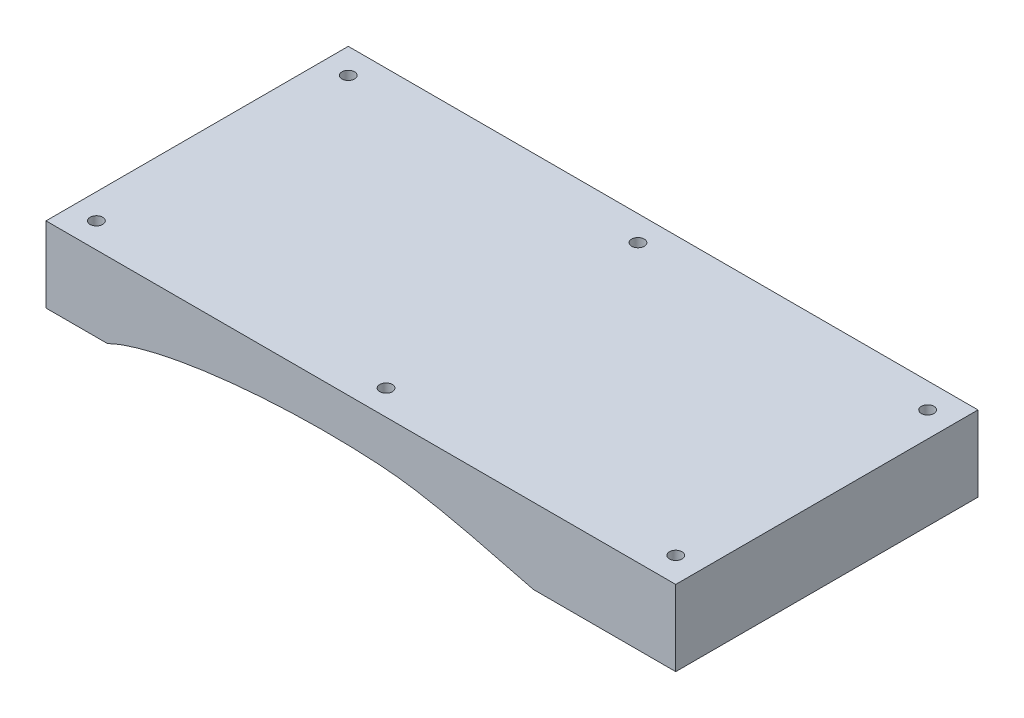
from build123d import *

# Parameters (mm, degrees)
BOSS_EXTRUDE1_DEPTH             = 120
SKETCH10_W                      = 2.5
SKETCH10_H                      = 10
F_5_0MM_DOWEL_HOLE1_AT_2_COUNT  = 2
F_5_0MM_DOWEL_HOLE1_AT_2_PITCH  = 230
F_5_0MM_DOWEL_HOLE1_AT_3_COUNT  = 2
F_5_0MM_DOWEL_HOLE1_AT_3_PITCH  = 250.79872408
F_5_0MM_DOWEL_HOLE1_AT_4_COUNT  = 2
F_5_0MM_DOWEL_HOLE1_AT_4_PITCH  = 152.397506541
F_5_0MM_DOWEL_HOLE1_AT_5_COUNT  = 2
F_5_0MM_DOWEL_HOLE1_AT_5_PITCH  = 100
F_5_0MM_DOWEL_HOLE1_AT_6_COUNT  = 2
F_5_0MM_DOWEL_HOLE1_AT_6_PITCH  = 115
SKETCH13_W                      = 5
SKETCH13_H                      = 20
F_10_0MM_DOWEL_HOLE1_AT_2_COUNT = 2
F_10_0MM_DOWEL_HOLE1_AT_2_PITCH = 115
F_10_0MM_DOWEL_HOLE1_AT_3_COUNT = 2
F_10_0MM_DOWEL_HOLE1_AT_3_PITCH = 230
F_10_0MM_DOWEL_HOLE1_AT_4_COUNT = 2
F_10_0MM_DOWEL_HOLE1_AT_4_PITCH = 250.79872408
F_10_0MM_DOWEL_HOLE1_AT_5_COUNT = 2
F_10_0MM_DOWEL_HOLE1_AT_5_PITCH = 152.397506541
F_10_0MM_DOWEL_HOLE1_AT_6_COUNT = 2
F_10_0MM_DOWEL_HOLE1_AT_6_PITCH = 100


with BuildPart() as part:
    # Sketch1 → Boss-Extrude1 (new body)
    with BuildSketch(Plane.XY):
        with BuildLine():
            Line((-20, 5), (4.406999064, 5))
            add(Edge.make_bspline(
                [(173.490575932, 5), (172.326342066, 5.286749118), (167.829693344, 6.405018282), (160.005568623, 8.421384221), (150.022959876, 10.929293239), (140.032690883, 13.242212873), (130.039576349, 15.224534417), (120.039677674, 16.776832577), (110.010328484, 17.519452934), (100.004268105, 17.93606864), (89.999557234, 18.039439262), (79.99597078, 17.88209955), (69.992122817, 17.447369698), (59.98803219, 16.737630926), (49.981633888, 15.747713143), (39.97167458, 14.434248174), (29.95037961, 12.743709227), (21.617032213, 10.901524907), (14.966560888, 9.053828582), (9.928778454, 7.425562721), (6.425978449, 5.993531691), (4.603660534, 5.099329751), (4.406999064, 5)],
                knots=[0.065553478, 0.065553478, 0.065553478, 0.065553478, 0.074294227, 0.099342978, 0.124359733, 0.149264719, 0.174009696, 0.198546974, 0.22290397, 0.247200686, 0.271477726, 0.295756352, 0.320054721, 0.344391349, 0.368786978, 0.393273071, 0.417900952, 0.442781229, 0.455381891, 0.468160436, 0.481314037, 0.482916031, 0.482916031, 0.482916031, 0.482916031], degree=3))
            Line((173.490575932, 5), (230, 5))
            Line((230, 5), (230, 35))
            Line((230, 35), (-20, 35))
            Line((-20, 35), (-20, 5))
        make_face()
    extrude(amount=BOSS_EXTRUDE1_DEPTH)

    # Sketch10 → Ø5.0mm Dowel Hole1 (revolve, cut)
    with BuildSketch(Plane(origin=(-10, 25, 10), x_dir=(0, 0, -1), z_dir=(1, 0, 0))):
        with Locations((1.25, 5)):
            Rectangle(SKETCH10_W, SKETCH10_H)
    f_5_0mm_dowel_hole1 = revolve(axis=Axis((-10, 18.65, 10), (0, 1, 0)), mode=Mode.SUBTRACT)

    # Ø5.0mm Dowel Hole1 at 2: Ø5.0mm Dowel Hole1 ×2
    with Locations(*[(i * F_5_0MM_DOWEL_HOLE1_AT_2_PITCH, 0, 0) for i in range(1, F_5_0MM_DOWEL_HOLE1_AT_2_COUNT)]):
        add(f_5_0mm_dowel_hole1, mode=Mode.SUBTRACT)

    # Ø5.0mm Dowel Hole1 at 3: Ø5.0mm Dowel Hole1 ×2
    with Locations(*[Vector(0.917070056253235, 0, 0.39872611141445) * (i * F_5_0MM_DOWEL_HOLE1_AT_3_PITCH) for i in range(1, F_5_0MM_DOWEL_HOLE1_AT_3_COUNT)]):
        add(f_5_0mm_dowel_hole1, mode=Mode.SUBTRACT)

    # Ø5.0mm Dowel Hole1 at 4: Ø5.0mm Dowel Hole1 ×2
    with Locations(*[Vector(0.7546055221635047, 0, 0.6561787149247866) * (i * F_5_0MM_DOWEL_HOLE1_AT_4_PITCH) for i in range(1, F_5_0MM_DOWEL_HOLE1_AT_4_COUNT)]):
        add(f_5_0mm_dowel_hole1, mode=Mode.SUBTRACT)

    # Ø5.0mm Dowel Hole1 at 5: Ø5.0mm Dowel Hole1 ×2
    with Locations(*[(0, 0, i * F_5_0MM_DOWEL_HOLE1_AT_5_PITCH) for i in range(1, F_5_0MM_DOWEL_HOLE1_AT_5_COUNT)]):
        add(f_5_0mm_dowel_hole1, mode=Mode.SUBTRACT)

    # Ø5.0mm Dowel Hole1 at 6: Ø5.0mm Dowel Hole1 ×2
    with Locations(*[(i * F_5_0MM_DOWEL_HOLE1_AT_6_PITCH, 0, 0) for i in range(1, F_5_0MM_DOWEL_HOLE1_AT_6_COUNT)]):
        add(f_5_0mm_dowel_hole1, mode=Mode.SUBTRACT)

    # Sketch13 → Ø10.0mm Dowel Hole1 (revolve, cut)
    with BuildSketch(Plane(origin=(-10, 25, 10), x_dir=(0, 0, 1), z_dir=(1, 0, 0))):
        with Locations((2.5, 10)):
            Rectangle(SKETCH13_W, SKETCH13_H)
    f_10_0mm_dowel_hole1 = revolve(axis=Axis((-10, 31.35, 10), (0, -1, 0)), mode=Mode.SUBTRACT)

    # Ø10.0mm Dowel Hole1 at 2: Ø10.0mm Dowel Hole1 ×2
    with Locations(*[(i * F_10_0MM_DOWEL_HOLE1_AT_2_PITCH, 0, 0) for i in range(1, F_10_0MM_DOWEL_HOLE1_AT_2_COUNT)]):
        add(f_10_0mm_dowel_hole1, mode=Mode.SUBTRACT)

    # Ø10.0mm Dowel Hole1 at 3: Ø10.0mm Dowel Hole1 ×2
    with Locations(*[(i * F_10_0MM_DOWEL_HOLE1_AT_3_PITCH, 0, 0) for i in range(1, F_10_0MM_DOWEL_HOLE1_AT_3_COUNT)]):
        add(f_10_0mm_dowel_hole1, mode=Mode.SUBTRACT)

    # Ø10.0mm Dowel Hole1 at 4: Ø10.0mm Dowel Hole1 ×2
    with Locations(*[Vector(0.917070056253235, 0, 0.39872611141445) * (i * F_10_0MM_DOWEL_HOLE1_AT_4_PITCH) for i in range(1, F_10_0MM_DOWEL_HOLE1_AT_4_COUNT)]):
        add(f_10_0mm_dowel_hole1, mode=Mode.SUBTRACT)

    # Ø10.0mm Dowel Hole1 at 5: Ø10.0mm Dowel Hole1 ×2
    with Locations(*[Vector(0.7546055221635047, 0, 0.6561787149247866) * (i * F_10_0MM_DOWEL_HOLE1_AT_5_PITCH) for i in range(1, F_10_0MM_DOWEL_HOLE1_AT_5_COUNT)]):
        add(f_10_0mm_dowel_hole1, mode=Mode.SUBTRACT)

    # Ø10.0mm Dowel Hole1 at 6: Ø10.0mm Dowel Hole1 ×2
    with Locations(*[(0, 0, i * F_10_0MM_DOWEL_HOLE1_AT_6_PITCH) for i in range(1, F_10_0MM_DOWEL_HOLE1_AT_6_COUNT)]):
        add(f_10_0mm_dowel_hole1, mode=Mode.SUBTRACT)


solid = part.part
